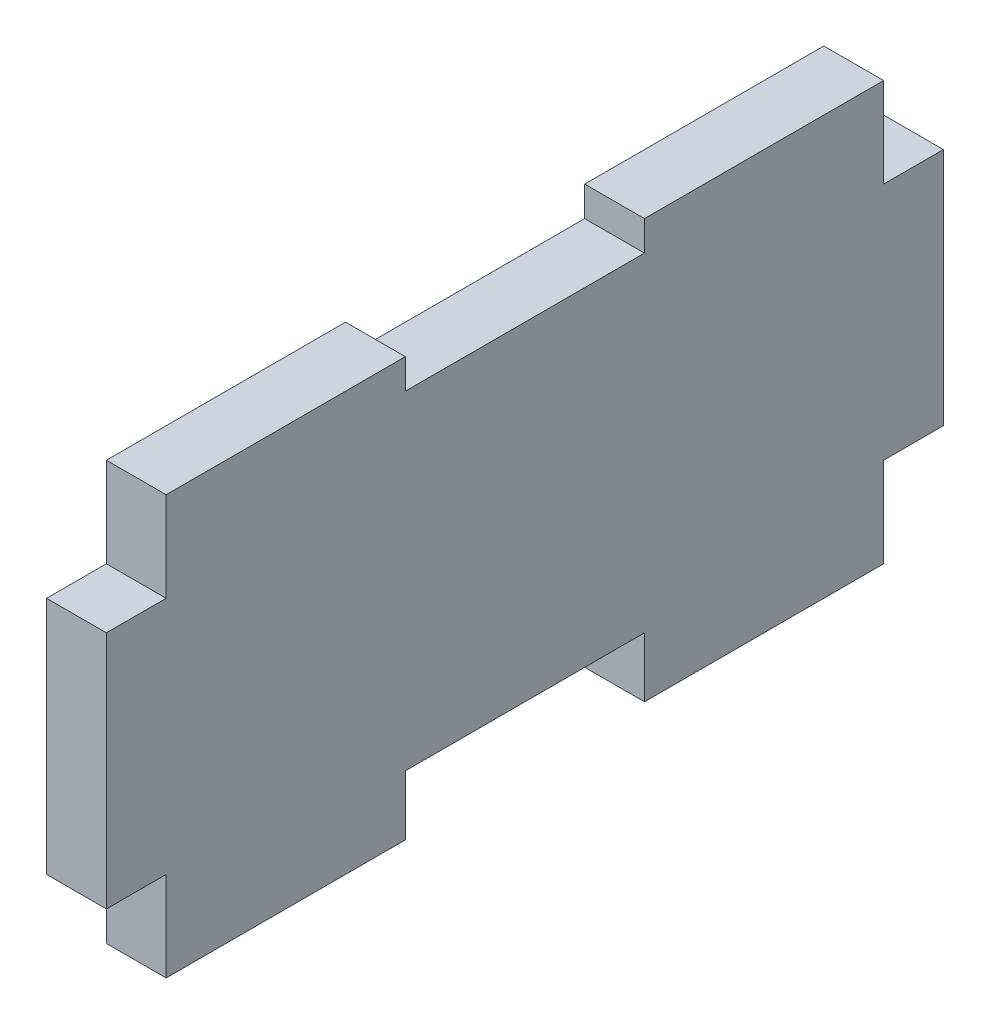
from build123d import *

# Parameters (mm, degrees)
BOSS_EXTRUDE1_DEPTH = 10


with BuildPart() as part:
    # Sketch1 → Boss-Extrude1 (new body)
    with BuildSketch(Plane(origin=(0, 0, 0), x_dir=(0, 0, -1), z_dir=(1, 0, 0))):
        Polygon((-90, 70), (-130, 70), (-130, 55), (-140, 55), (-140, 15), (-130, 15), (-130, 0), (-90, 0), (-90, 10), (-50, 10), (-50, 0), (-10, 0), (-10, 15), (0, 15), (0, 55), (-10, 55), (-10, 70), (-50, 70), (-50, 65), (-90, 65), align=None)
    extrude(amount=BOSS_EXTRUDE1_DEPTH)


solid = part.part
